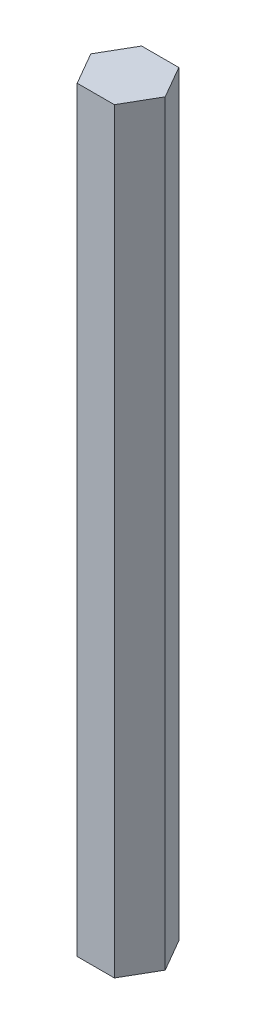
from build123d import *

# Parameters (mm, degrees)
BOSS_EXTRUDE1_DEPTH = 61
SKETCH3_R           = 1.6
CUT_EXTRUDE1_DEPTH  = 5


with BuildPart() as part:
    # Sketch1 → Boss-Extrude1 (new body)
    with BuildSketch(Plane(origin=(0, 0, 0), x_dir=(1, 0, 0), z_dir=(0, 1, 0))):
        Polygon((3, 0), (1.5, 2.598076211), (-1.5, 2.598076211), (-3, 0), (-1.5, -2.598076211), (1.5, -2.598076211), align=None)
    extrude(amount=BOSS_EXTRUDE1_DEPTH)

    # Sketch3 → Cut-Extrude1 (cut)
    with BuildSketch(Plane.XZ):
        with Locations(Location((0, 0, 0), (0, 0, 270))):
            Circle(SKETCH3_R)
    extrude(amount=-CUT_EXTRUDE1_DEPTH, mode=Mode.SUBTRACT)


solid = part.part
